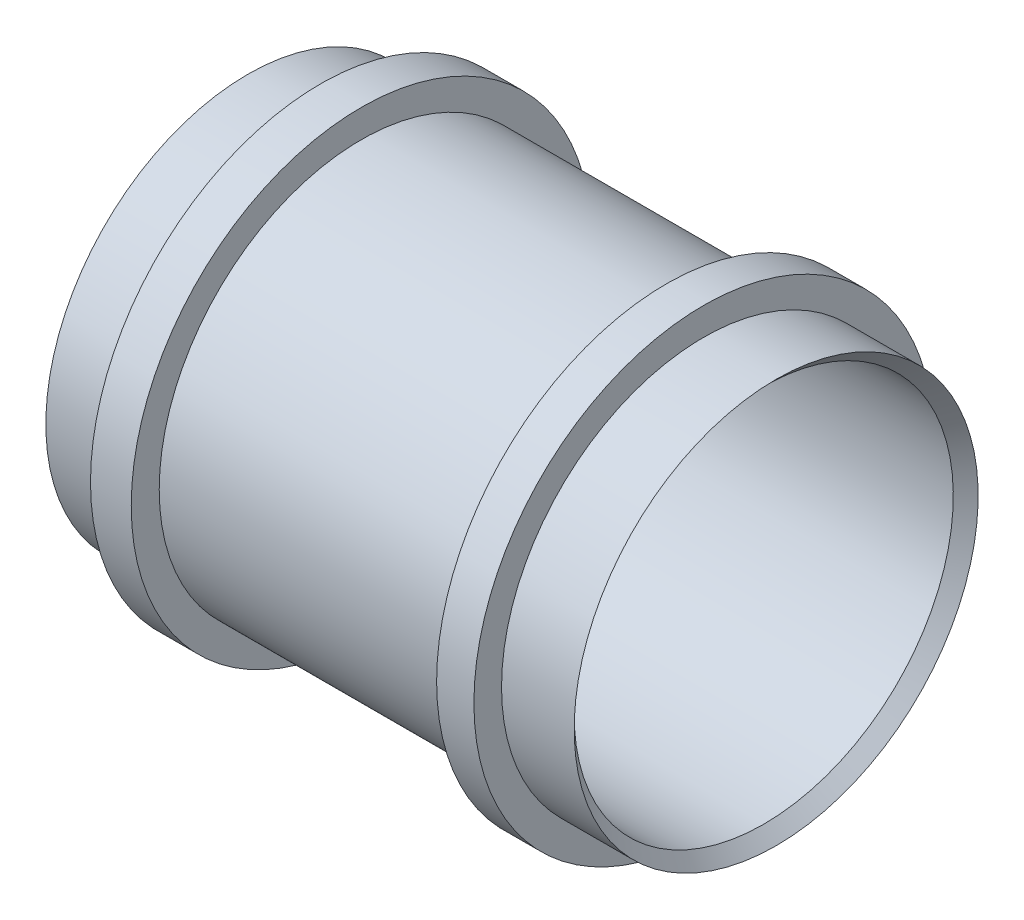
from build123d import *

# Parameters (mm, degrees)
SKETCH9_W  = 13.112773862
SKETCH9_H  = 9
SKETCH11_W = 12
SKETCH11_H = 8.89


with BuildPart() as part:
    # Sketch1 → Revolve2 (revolve)
    with BuildSketch(Plane.XY, mode=Mode.PRIVATE) as revolve2_sk:
        Polygon((52.912966218, 65), (-117.087033782, 65), (-113.087033782, 61), (48.912966218, 61), align=None)
    revolve(revolve2_sk.sketch.rotate(Axis((-117.087033782, 0, 0), (1, 0, 0)), 180), axis=Axis((-117.087033782, 0, 0), (1, 0, 0)))

    # Sketch9 → Revolve4 (revolve)
    with BuildSketch(Plane.XY, mode=Mode.PRIVATE) as revolve4_sk:
        with Locations((-87.162646851, 69.5)):
            Rectangle(SKETCH9_W, SKETCH9_H)
    revolve(revolve4_sk.sketch.rotate(Axis((-161.549470518, 0, 0), (1, 0, 0)), 180), axis=Axis((-161.549470518, 0, 0), (1, 0, 0)))

    # Sketch11 → Revolve5 (revolve)
    with BuildSketch(Plane.XY, mode=Mode.PRIVATE) as revolve5_sk:
        with Locations((23.544966218, 69.445)):
            Rectangle(SKETCH11_W, SKETCH11_H)
    revolve(revolve5_sk.sketch.rotate(Axis((-147.745174043, 0, 0), (1, 0, 0)), 180), axis=Axis((-147.745174043, 0, 0), (1, 0, 0)))


solid = part.part
